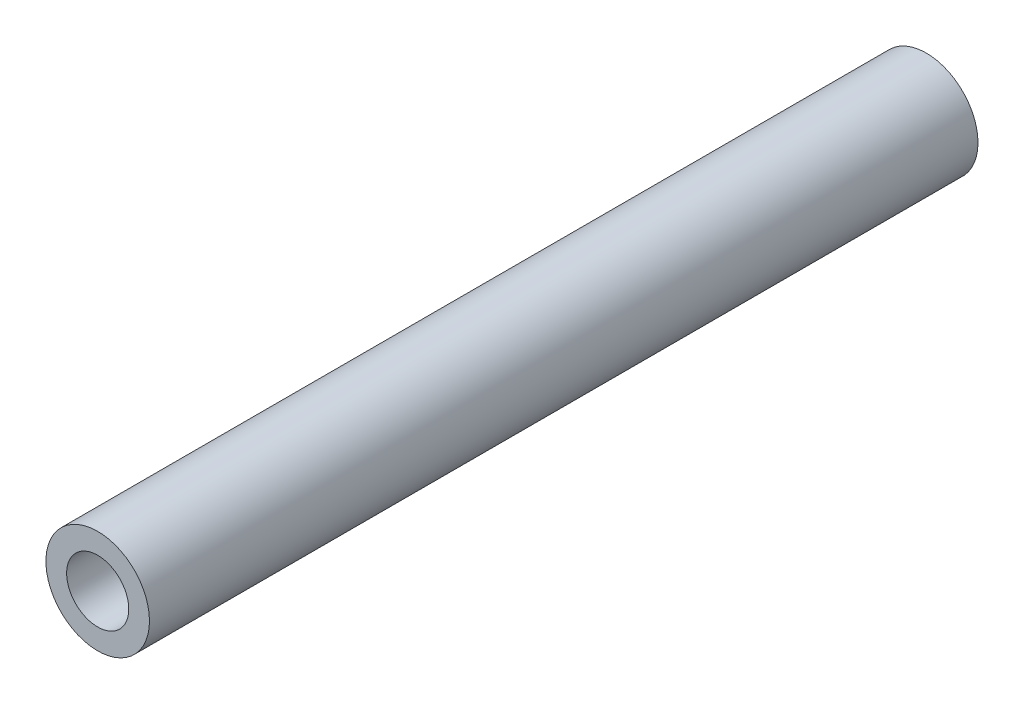
from build123d import *

# Parameters (mm, degrees)
SKETCH_1_R      = 2.5
SKETCH_1_R_2    = 1.5
EXTRUDE_1_DEPTH = 40


with BuildPart() as part:
    # 草图1 → 凸台-拉伸1 (new body)
    with BuildSketch(Plane.XY):
        Circle(SKETCH_1_R)
        Circle(SKETCH_1_R_2, mode=Mode.SUBTRACT)
    extrude(amount=EXTRUDE_1_DEPTH)


solid = part.part
